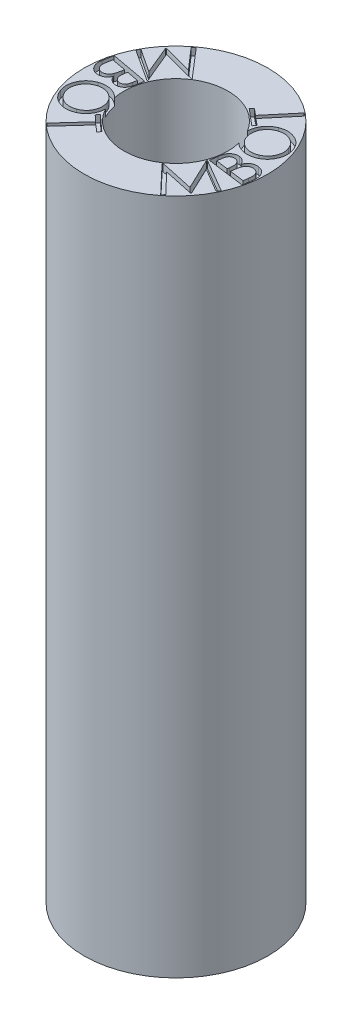
from build123d import *

# Parameters (mm, degrees)
SKETCH1_R           = 3.8
SKETCH1_R_2         = 2.15
BOSS_EXTRUDE1_DEPTH = 28
CUT_EXTRUDE1_DEPTH  = 0.3


with BuildPart() as part:
    # Sketch1 → Boss-Extrude1 (new body)
    with BuildSketch(Plane(origin=(0, 0, 0), x_dir=(1, 0, 0), z_dir=(0, 1, 0))):
        with Locations(Location((0, 0, 0), (0, 0, 270))):
            Circle(SKETCH1_R)
        with Locations(Location((0, 0, 0), (0, 0, 270))):
            Circle(SKETCH1_R_2, mode=Mode.SUBTRACT)
    extrude(amount=BOSS_EXTRUDE1_DEPTH)

    # Sketch5 → Cut-Extrude1 (cut)
    # profile 1 of 8: a face of its own
    with BuildSketch(Plane(origin=(0, 28, 0), x_dir=(1, 0, 0), z_dir=(0, 1, 0))):
        Polygon((2.329630541, -2.964133003), (1.227093983, -1.803082823), (1.242994424, -1.783048267), (2.662903779, -2.08547465), (2.039606503, -0.777822406), (2.055824952, -0.757469842), (3.439481303, -1.563622186), (3.342170606, -1.686373588), (2.357615317, -1.10378144), (2.897912292, -2.247023127), (2.873107605, -2.278506), (1.624923009, -2.013604658), (2.424715177, -2.84424368), align=None)
    # profile 2 of 8: a face of its own
    with BuildSketch(Plane(origin=(0, 28, 0), x_dir=(1, 0, 0), z_dir=(0, 1, 0))):
        with BuildLine():
            Line((2.093235979, -0.715965441), (2.134259116, -0.407496891))
            add(Edge.make_bspline(
                [(2.134259116, -0.407496891), (2.136386266, -0.392429351), (2.140501561, -0.363278903), (2.148119693, -0.321032291), (2.157029972, -0.281695393), (2.166773772, -0.24516186), (2.177573031, -0.211604428), (2.189423383, -0.180956688), (2.201837571, -0.152895384), (2.220633469, -0.120023992), (2.24666193, -0.082957763), (2.283862184, -0.044715463), (2.325806995, -0.01201122), (2.373036733, 0.01322043), (2.423060482, 0.03308958), (2.475692439, 0.044186614), (2.529781919, 0.048973149), (2.565915283, 0.045301708), (2.584241588, 0.043439607)],
                knots=[0, 0, 0, 0, 1.010492077, 1.954950526, 2.849835635, 3.6882845, 4.465225562, 5.18948145, 5.869957772, 6.500383296, 7.701699132, 8.866658841, 10.031107976, 11.218795508, 12.4110639, 13.593042317, 14.779226817, 16, 16, 16, 16], degree=3))
            add(Edge.make_bspline(
                [(2.584241588, 0.043439607), (2.601193217, 0.040473985), (2.634571517, 0.034634581), (2.682445123, 0.018601863), (2.726796866, -0.004091918), (2.767940708, -0.032322519), (2.804931653, -0.066542604), (2.837419246, -0.106168686), (2.865124596, -0.151274755), (2.878747978, -0.184459178), (2.885713944, -0.20142718)],
                knots=[0, 0, 0, 0, 1.009141512, 1.98703192, 2.949821253, 3.924956337, 4.906876531, 5.897139441, 6.924756299, 8, 8, 8, 8], degree=3))
            add(Edge.make_bspline(
                [(2.885713944, -0.20142718), (2.89530569, -0.183045396), (2.913565789, -0.148051431), (2.943796678, -0.100370392), (2.974856322, -0.059972172), (3.007275793, -0.026458196), (3.041267223, 0.001425224), (3.077519354, 0.024722129), (3.116006399, 0.044265986), (3.156912499, 0.059210154), (3.199585367, 0.069628841), (3.243471151, 0.075790248), (3.288525047, 0.07681903), (3.3185435, 0.073663126), (3.333788363, 0.0720604)],
                knots=[0, 0, 0, 0, 1.318659286, 2.510372038, 3.586869774, 4.555018033, 5.470331833, 6.377585435, 7.291432246, 8.211009337, 9.141696873, 10.081139435, 11.025507152, 12, 12, 12, 12], degree=3))
            add(Edge.make_bspline(
                [(3.333788363, 0.0720604), (3.349116564, 0.069615985), (3.37936596, 0.064792061), (3.423080884, 0.05224959), (3.464321257, 0.035528557), (3.503480767, 0.0152818), (3.539756938, -0.009780892), (3.573649179, -0.038633678), (3.605419448, -0.07131323), (3.634393713, -0.107958846), (3.660119019, -0.147817752), (3.681523856, -0.190357979), (3.698517441, -0.23521639), (3.71086791, -0.282550348), (3.718921913, -0.332384858), (3.721726551, -0.384663586), (3.721039716, -0.439231466), (3.716885993, -0.476103241), (3.714762922, -0.494949315)],
                knots=[0, 0, 0, 0, 0.972846954, 1.91986211, 2.844560866, 3.760494506, 4.678837868, 5.603321497, 6.548350927, 7.532670636, 8.528530662, 9.518626182, 10.513864628, 11.531414505, 12.581795599, 13.674155164, 14.811203275, 16, 16, 16, 16], degree=3))
            Line((3.714762922, -0.494949315), (3.657521336, -0.924579223))
            Line((3.657521336, -0.924579223), (2.093235979, -0.715965441))
        make_face()
        with BuildLine():
            Line((2.266868792, -0.583355766), (2.767732674, -0.650137616))
            Line((2.767732674, -0.650137616), (2.779499, -0.56077714))
            add(Edge.make_bspline(
                [(2.779499, -0.56077714), (2.78115923, -0.547640968), (2.784368254, -0.522250327), (2.787876549, -0.485344488), (2.79009341, -0.451092713), (2.791279363, -0.419371959), (2.790443894, -0.390307046), (2.789126709, -0.363634235), (2.785973029, -0.339613466), (2.78007089, -0.311349699), (2.769756007, -0.278958001), (2.752122322, -0.24340643), (2.729668375, -0.211071597), (2.702164937, -0.18306515), (2.67152079, -0.158644049), (2.637489112, -0.139920522), (2.601004277, -0.125983293), (2.575339747, -0.121605413), (2.56229898, -0.119380906)],
                knots=[0, 0, 0, 0, 1.138442701, 2.200472903, 3.186909168, 4.089663252, 4.928399444, 5.686278047, 6.38495409, 7.008817847, 8.167548536, 9.296648921, 10.409220836, 11.537253861, 12.660415745, 13.766134315, 14.864918994, 16, 16, 16, 16], degree=3))
            add(Edge.make_bspline(
                [(2.56229898, -0.119380906), (2.553511374, -0.118497579), (2.536389248, -0.116776468), (2.511120296, -0.116612732), (2.487005545, -0.119536438), (2.464041868, -0.12507009), (2.441869548, -0.132487832), (2.421226169, -0.143235763), (2.401470606, -0.156049104), (2.383091011, -0.171641272), (2.365995637, -0.19008602), (2.350412765, -0.211367428), (2.336781392, -0.235957638), (2.324338982, -0.263356807), (2.313636805, -0.293934026), (2.30459409, -0.327460952), (2.296374973, -0.363791497), (2.292858924, -0.389230347), (2.291037462, -0.40240875)],
                knots=[0, 0, 0, 0, 0.950473913, 1.85194156, 2.713905182, 3.558086579, 4.391713354, 5.223541917, 6.055918173, 6.922326683, 7.810479481, 8.757659798, 9.75408104, 10.831618649, 11.993747566, 13.236759292, 14.568524148, 16, 16, 16, 16], degree=3))
            Line((2.291037462, -0.40240875), (2.266868792, -0.583355766))
        make_face(mode=Mode.SUBTRACT)
        with BuildLine():
            Line((2.925147037, -0.671126198), (3.524593652, -0.751264419))
            Line((3.524593652, -0.751264419), (3.550352366, -0.557597052))
            add(Edge.make_bspline(
                [(3.550352366, -0.557597052), (3.552153449, -0.543828126), (3.555638926, -0.51718234), (3.558974021, -0.47844883), (3.561431739, -0.442404461), (3.561953166, -0.409088741), (3.561551703, -0.378512614), (3.559224862, -0.350710568), (3.55594797, -0.325477107), (3.549192061, -0.295781234), (3.537368704, -0.261755065), (3.518175463, -0.224062191), (3.493458991, -0.189690474), (3.463536834, -0.159425306), (3.430256543, -0.133462816), (3.394050712, -0.11308558), (3.355559136, -0.098375275), (3.328595408, -0.093521032), (3.315025843, -0.091078121)],
                knots=[0, 0, 0, 0, 1.126627012, 2.180261895, 3.154089933, 4.057406986, 4.88332626, 5.634071565, 6.320142425, 6.946160866, 8.10224948, 9.233235086, 10.367127989, 11.522800553, 12.675524478, 13.780837104, 14.883200617, 16, 16, 16, 16], degree=3))
            add(Edge.make_bspline(
                [(3.315025843, -0.091078121), (3.297961476, -0.089581196), (3.264562852, -0.086651393), (3.214725076, -0.093402357), (3.167335455, -0.109278542), (3.122766119, -0.134009711), (3.081930605, -0.16650165), (3.046280306, -0.206734905), (3.015567894, -0.253934574), (3.000610023, -0.289347901), (2.992882914, -0.307642124)],
                knots=[0, 0, 0, 0, 0.975195556, 1.908666771, 2.846069973, 3.812671006, 4.80281988, 5.80962802, 6.868472574, 8, 8, 8, 8], degree=3))
            add(Edge.make_bspline(
                [(2.992882914, -0.307642124), (2.990386491, -0.314724774), (2.985024226, -0.329938156), (2.977667325, -0.354949229), (2.970925287, -0.383783656), (2.963869569, -0.416320722), (2.956949315, -0.452596285), (2.949917491, -0.492542068), (2.943295959, -0.536354032), (2.939102875, -0.566814261), (2.936913363, -0.582719748)],
                knots=[0, 0, 0, 0, 0.640922909, 1.37668893, 2.223753324, 3.16784577, 4.218320023, 5.375583151, 6.629602244, 8, 8, 8, 8], degree=3))
            Line((2.936913363, -0.582719748), (2.925147037, -0.671126198))
        make_face(mode=Mode.SUBTRACT)
    # profile 3 of 8: a face of its own
    with BuildSketch(Plane(origin=(0, 28, 0), x_dir=(1, 0, 0), z_dir=(0, 1, 0))):
        with BuildLine():
            add(Edge.make_bspline(
                [(1.903773327, 0.784406789), (1.893312162, 0.811799631), (1.872709074, 0.865749369), (1.850826798, 0.948287825), (1.837232328, 1.030395749), (1.832148913, 1.111903426), (1.835187697, 1.193032367), (1.84727733, 1.273410426), (1.86692837, 1.353395094), (1.895307748, 1.431774342), (1.930598895, 1.507105543), (1.971957653, 1.577969527), (2.019923047, 1.642817534), (2.074054695, 1.701949106), (2.133950636, 1.75571152), (2.200421574, 1.803084506), (2.27240279, 1.845594185), (2.32403111, 1.868374842), (2.350257702, 1.879947153)],
                knots=[0, 0, 0, 0, 1.0654412, 2.09836841, 3.098110652, 4.08658876, 5.062342022, 6.04389219, 7.036508341, 8.051911371, 9.069067994, 10.057162908, 11.029867363, 11.995499962, 12.967127432, 13.950015722, 14.958631591, 16, 16, 16, 16], degree=3))
            add(Edge.make_bspline(
                [(2.350257702, 1.879947153), (2.376792525, 1.890133892), (2.429005749, 1.910178588), (2.509454042, 1.930582205), (2.589571079, 1.943781692), (2.669743943, 1.947637467), (2.749698984, 1.944110277), (2.829322178, 1.931278323), (2.908822575, 1.91096153), (2.9870548, 1.882299791), (3.062591577, 1.847190383), (3.133168581, 1.805217842), (3.198462997, 1.7578979), (3.257614764, 1.704032994), (3.311037385, 1.64426044), (3.358397845, 1.578368135), (3.400623928, 1.506859151), (3.423198627, 1.455659023), (3.434667758, 1.429646673)],
                knots=[0, 0, 0, 0, 1.042580017, 2.051510351, 3.040546498, 4.018567053, 4.992507237, 5.973248902, 6.973671327, 8.000291144, 9.02736072, 10.027063942, 11.010080281, 11.982503429, 12.958105746, 13.947417434, 14.957180371, 16, 16, 16, 16], degree=3))
            add(Edge.make_bspline(
                [(3.434667758, 1.429646673), (3.444915579, 1.402783004), (3.465093661, 1.349888121), (3.486424958, 1.268734794), (3.499303979, 1.187866563), (3.503663791, 1.107215423), (3.500437705, 1.026827449), (3.487892205, 0.946790475), (3.468028459, 0.866998731), (3.439274577, 0.788688158), (3.403977798, 0.713404904), (3.363123869, 0.642464431), (3.315300846, 0.578138507), (3.262238059, 0.519052324), (3.203256697, 0.465926891), (3.138524415, 0.418387742), (3.067645191, 0.377297398), (3.017234509, 0.354755159), (2.99168148, 0.343328564)],
                knots=[0, 0, 0, 0, 1.055830582, 2.078942983, 3.076562134, 4.059560474, 5.041979955, 6.026859162, 7.0309954, 8.058538785, 9.086532333, 10.083185466, 11.060806588, 12.025989644, 12.996673523, 13.971987714, 14.972006452, 16, 16, 16, 16], degree=3))
            add(Edge.make_bspline(
                [(2.99168148, 0.343328564), (2.974178528, 0.336386036), (2.939368036, 0.322578493), (2.885880608, 0.306689164), (2.832195677, 0.293738086), (2.778211629, 0.284623597), (2.723845442, 0.278709677), (2.669116641, 0.276944194), (2.613994482, 0.278517703), (2.558868227, 0.283600677), (2.504345858, 0.292065962), (2.451065265, 0.304286822), (2.399217518, 0.319515275), (2.348771129, 0.33790465), (2.300017389, 0.360061645), (2.252588386, 0.385130311), (2.206576299, 0.413588381), (2.162271785, 0.445241084), (2.120237593, 0.479702415), (2.080803869, 0.516538788), (2.044204397, 0.55560177), (2.010609142, 0.597141092), (1.979033907, 0.640319612), (1.951395413, 0.686383129), (1.925458943, 0.734110429), (1.911046929, 0.767536819), (1.903773327, 0.784406789)],
                knots=[0, 0, 0, 0, 1.037653303, 2.063721596, 3.072992308, 4.080857644, 5.079924507, 6.085737525, 7.097205503, 8.118385624, 9.135896792, 10.136825087, 11.129874092, 12.113506166, 13.094391291, 14.080000588, 15.069328101, 16.074801489, 17.079765218, 18.063848587, 19.047931957, 20.02822496, 21.00789062, 21.994158109, 22.987671321, 24, 24, 24, 24], degree=3))
        make_face()
        with BuildLine():
            add(Edge.make_bspline(
                [(2.044015214, 0.850552622), (2.049744542, 0.837203671), (2.061125717, 0.810686293), (2.081851815, 0.77269482), (2.104580963, 0.736193513), (2.129961624, 0.701309274), (2.157482676, 0.66797279), (2.187687496, 0.636350895), (2.219986519, 0.606062952), (2.254900909, 0.578019602), (2.291376325, 0.551923728), (2.329101535, 0.528475711), (2.367858343, 0.50763317), (2.407556577, 0.489494278), (2.448354683, 0.474166341), (2.490163593, 0.461842375), (2.532818768, 0.451856066), (2.576393178, 0.444958466), (2.620474022, 0.440672108), (2.664772538, 0.440019701), (2.709010609, 0.441177281), (2.753123058, 0.446758185), (2.79729953, 0.454030705), (2.841386406, 0.46519546), (2.885548996, 0.478610915), (2.914473901, 0.489948047), (2.929033744, 0.495654785)],
                knots=[0, 0, 0, 0, 0.985772182, 1.958213211, 2.934693914, 3.903532952, 4.884907928, 5.867417, 6.870585278, 7.888922104, 8.905426197, 9.913949962, 10.902476839, 11.891213282, 12.87506575, 13.858760266, 14.848622371, 15.847236651, 16.851978487, 17.852587691, 18.853610927, 19.853443361, 20.868621756, 21.891500729, 22.938650967, 24, 24, 24, 24], degree=3))
            add(Edge.make_bspline(
                [(2.929033744, 0.495654785), (2.9501094, 0.505016839), (2.99160104, 0.523447911), (3.049628485, 0.55740721), (3.102883893, 0.59584009), (3.151473258, 0.638792505), (3.194778331, 0.686724788), (3.233233502, 0.739097502), (3.267131152, 0.795849809), (3.295319043, 0.856825122), (3.318083131, 0.919934881), (3.334851545, 0.983761102), (3.344824155, 1.047698256), (3.347924712, 1.111636132), (3.344839007, 1.175584404), (3.334790867, 1.239489812), (3.318318768, 1.303436228), (3.302464746, 1.344979932), (3.294425871, 1.36604491)],
                knots=[0, 0, 0, 0, 1.052617708, 2.072288217, 3.06394441, 4.048162943, 5.028408386, 6.008330982, 7.011314847, 8.042289403, 9.071386676, 10.07184354, 11.051670456, 12.021144701, 12.990618947, 13.970445863, 14.970902727, 16, 16, 16, 16], degree=3))
            add(Edge.make_bspline(
                [(3.294425871, 1.36604491), (3.288339879, 1.380009591), (3.276323342, 1.407582272), (3.255458116, 1.447357995), (3.232146335, 1.485177414), (3.206867375, 1.521449872), (3.179034152, 1.555590803), (3.148978635, 1.587780427), (3.116902984, 1.618380873), (3.082601565, 1.646829711), (3.046844978, 1.673271929), (3.009585065, 1.696747506), (2.971301562, 1.717615581), (2.931760985, 1.735301141), (2.891365252, 1.750688567), (2.849820134, 1.763169033), (2.807162776, 1.772575923), (2.763644515, 1.779631585), (2.719663101, 1.783817043), (2.675458618, 1.78467925), (2.631373214, 1.782813892), (2.587298825, 1.777974179), (2.543278585, 1.770416023), (2.499454457, 1.759484545), (2.455584337, 1.745800059), (2.426835549, 1.734578557), (2.412269421, 1.728892967)],
                knots=[0, 0, 0, 0, 1.030548109, 2.034774194, 3.036152788, 4.035113646, 5.024292458, 6.013965269, 7.013466766, 8.02185973, 9.027544907, 10.020539299, 10.999444249, 11.975375117, 12.949221365, 13.922750572, 14.90770734, 15.902978888, 16.904357482, 17.8944461, 18.892402135, 19.888087153, 20.892799837, 21.912254857, 22.942203694, 24, 24, 24, 24], degree=3))
            add(Edge.make_bspline(
                [(2.412269421, 1.728892967), (2.398094491, 1.722695106), (2.370014872, 1.710417547), (2.329548048, 1.689292106), (2.291011483, 1.666304971), (2.255029244, 1.640431673), (2.220515645, 1.613430132), (2.188755434, 1.583518847), (2.158673214, 1.551999992), (2.130808108, 1.518440876), (2.105406385, 1.4831056), (2.082334604, 1.446419108), (2.062071673, 1.408208376), (2.044088757, 1.368781951), (2.029338379, 1.327830886), (2.016326069, 1.28580484), (2.006677805, 1.242163149), (1.999327297, 1.197585848), (1.994877185, 1.152541494), (1.993409865, 1.107727217), (1.994118092, 1.063418149), (1.998389014, 1.019759287), (2.005392022, 0.9766291), (2.015271652, 0.934032204), (2.027947294, 0.891821903), (2.038634405, 0.864372839), (2.044015214, 0.850552622)],
                knots=[0, 0, 0, 0, 1.050823242, 2.08161283, 3.099362736, 4.096492701, 5.090783653, 6.074295993, 7.057491853, 8.049693955, 9.035103037, 10.012266315, 10.991735883, 11.971629006, 12.95366357, 13.947015083, 14.958630831, 15.987531717, 17.01517154, 18.031289292, 19.032597937, 20.023701631, 21.008794843, 21.999348877, 22.992700389, 24, 24, 24, 24], degree=3))
        make_face(mode=Mode.SUBTRACT)
    # profile 4 of 8: a face of its own
    with BuildSketch(Plane(origin=(0, 28, 0), x_dir=(1, 0, 0), z_dir=(0, 1, 0))):
        Polygon((1.836431063, 1.514654737), (1.737848331, 1.396991476), (1.072255883, 1.955414953), (1.170838615, 2.073078214), (1.441464116, 1.846019921), (2.360827598, 2.941560286), (2.484533026, 2.837889412), (1.565169545, 1.742349048), align=None)
    # profile 5 of 8: a face of its own
    with BuildSketch(Plane(origin=(0, 28, 0), x_dir=(1, 0, 0), z_dir=(0, 1, 0))):
        Polygon((-2.215025584, 3.052642951), (-1.17831685, 1.848025564), (-1.194853308, 1.828945035), (-2.588049923, 2.197835259), (-2.033442551, 0.871102487), (-2.050297018, 0.851703949), (-3.383071958, 1.718277967), (-3.28067312, 1.834987202), (-2.332688845, 1.209463865), (-2.813200163, 2.36924201), (-2.78712344, 2.399134838), (-1.562471497, 2.076355892), (-2.314880351, 2.938477787), align=None)
    # profile 6 of 8: a face of its own
    with BuildSketch(Plane(origin=(0, 28, 0), x_dir=(1, 0, 0), z_dir=(0, 1, 0))):
        with BuildLine():
            Line((-2.071357534, 0.780700688), (-2.127645094, 0.475094217))
            add(Edge.make_bspline(
                [(-2.127645094, 0.475094217), (-2.130503997, 0.460230628), (-2.136078004, 0.431251066), (-2.145993134, 0.389498369), (-2.156314704, 0.350593317), (-2.16786591, 0.314750253), (-2.180171715, 0.281700861), (-2.19338732, 0.25145484), (-2.20779928, 0.224345018), (-2.227474528, 0.192237631), (-2.255491615, 0.156897769), (-2.294112725, 0.12040441), (-2.337818192, 0.090175819), (-2.386066793, 0.066914484), (-2.437104724, 0.050307298), (-2.489999967, 0.04134226), (-2.544158672, 0.039778907), (-2.580107676, 0.045032177), (-2.598298139, 0.047690371)],
                knots=[0, 0, 0, 0, 1.00663649, 1.962640647, 2.853729908, 3.68319098, 4.46631897, 5.198668758, 5.876776699, 6.506812784, 7.701556656, 8.863713625, 10.029351552, 11.221304401, 12.414195262, 13.58723036, 14.779120649, 16, 16, 16, 16], degree=3))
            add(Edge.make_bspline(
                [(-2.598298139, 0.047690371), (-2.615087502, 0.051329054), (-2.648084862, 0.058480422), (-2.694714839, 0.077690346), (-2.738312276, 0.10165514), (-2.777839249, 0.132123755), (-2.813151943, 0.168003517), (-2.843385827, 0.209250127), (-2.868654908, 0.255700172), (-2.880808659, 0.28929641), (-2.887050142, 0.306549546)],
                knots=[0, 0, 0, 0, 1.00808686, 1.981266667, 2.952109378, 3.925528571, 4.903782706, 5.902115156, 6.922644458, 8, 8, 8, 8], degree=3))
            add(Edge.make_bspline(
                [(-2.887050142, 0.306549546), (-2.897482271, 0.288672586), (-2.917346898, 0.254631677), (-2.950009634, 0.208678858), (-2.982421933, 0.169374299), (-3.016509561, 0.137577942), (-3.051877446, 0.111660253), (-3.089126743, 0.090202878), (-3.128506322, 0.072633019), (-3.170030638, 0.059669665), (-3.212964698, 0.050862757), (-3.257037912, 0.047707624), (-3.301964016, 0.048228949), (-3.331767635, 0.052934729), (-3.346890887, 0.055322583)],
                knots=[0, 0, 0, 0, 1.318356294, 2.510384727, 3.58892852, 4.559139976, 5.472469055, 6.377365833, 7.293687642, 8.21448031, 9.144469175, 10.079620131, 11.025541494, 12, 12, 12, 12], degree=3))
            add(Edge.make_bspline(
                [(-3.346890887, 0.055322583), (-3.362026474, 0.058503835), (-3.391969342, 0.064797335), (-3.43486702, 0.079626973), (-3.475277444, 0.098108857), (-3.513018566, 0.120626962), (-3.548567681, 0.146619591), (-3.581039547, 0.177185371), (-3.611171424, 0.211403355), (-3.63820075, 0.249398427), (-3.66231074, 0.290226905), (-3.681194841, 0.33402521), (-3.696085782, 0.379756188), (-3.705804901, 0.427779313), (-3.711166591, 0.477814121), (-3.7120846, 0.530062804), (-3.708261726, 0.584431752), (-3.70229282, 0.621098179), (-3.699244653, 0.639822783)],
                knots=[0, 0, 0, 0, 0.969793175, 1.918550522, 2.841273926, 3.753967429, 4.672002961, 5.599247377, 6.546697831, 7.528801654, 8.521437843, 9.516367295, 10.515646089, 11.534571192, 12.585080277, 13.669581761, 14.809915174, 16, 16, 16, 16], degree=3))
            Line((-3.699244653, 0.639822783), (-3.621014485, 1.065318576))
            Line((-3.621014485, 1.065318576), (-2.071357534, 0.780700688))
        make_face()
        with BuildLine():
            Line((-2.251032514, 0.656995259), (-2.747126264, 0.74794578))
            Line((-2.747126264, 0.74794578), (-2.763344713, 0.65953933))
            add(Edge.make_bspline(
                [(-2.763344713, 0.65953933), (-2.765625525, 0.646510176), (-2.770031231, 0.621342555), (-2.775518388, 0.584783145), (-2.779402493, 0.550737614), (-2.781615911, 0.51911409), (-2.782591998, 0.490050125), (-2.782453381, 0.46339639), (-2.780523462, 0.439287061), (-2.776447055, 0.410690871), (-2.767646025, 0.377952238), (-2.751738945, 0.341707596), (-2.731096306, 0.308393276), (-2.705173716, 0.278827029), (-2.67542787, 0.253509567), (-2.642588474, 0.232891496), (-2.606956903, 0.217137933), (-2.581571708, 0.211471051), (-2.568723319, 0.208602831)],
                knots=[0, 0, 0, 0, 1.13936992, 2.200851349, 3.18399813, 4.090228388, 4.930730959, 5.688662629, 6.384781242, 7.012370336, 8.175208003, 9.291475818, 10.411323097, 11.537444079, 12.664527147, 13.764050466, 14.868302939, 16, 16, 16, 16], degree=3))
            add(Edge.make_bspline(
                [(-2.568723319, 0.208602831), (-2.560050111, 0.207261182), (-2.543089222, 0.20463752), (-2.517822744, 0.20374199), (-2.493515229, 0.205269044), (-2.470251422, 0.209391381), (-2.447957755, 0.21604157), (-2.426998396, 0.225822875), (-2.406664183, 0.237571989), (-2.387530601, 0.252313878), (-2.369648959, 0.269971744), (-2.353006892, 0.290543297), (-2.337692057, 0.314167594), (-2.324220056, 0.341062859), (-2.311665391, 0.370736849), (-2.301050832, 0.40368212), (-2.291444453, 0.439658648), (-2.286400766, 0.464885314), (-2.283787422, 0.477956297)],
                knots=[0, 0, 0, 0, 0.944954498, 1.847905489, 2.717818052, 3.564707142, 4.388483539, 5.216524553, 6.050999793, 6.914515577, 7.811014505, 8.752857749, 9.760285637, 10.838092965, 11.989913049, 13.228767073, 14.564109175, 16, 16, 16, 16], degree=3))
            Line((-2.283787422, 0.477956297), (-2.251032514, 0.656995259))
        make_face(mode=Mode.SUBTRACT)
        with BuildLine():
            Line((-2.903268591, 0.776566573), (-3.497309056, 0.885643596))
            Line((-3.497309056, 0.885643596), (-3.532608035, 0.693884282))
            add(Edge.make_bspline(
                [(-3.532608035, 0.693884282), (-3.535026891, 0.680223805), (-3.539704271, 0.653808327), (-3.545056708, 0.615409111), (-3.549038785, 0.579569946), (-3.551102724, 0.546355748), (-3.552418933, 0.515798481), (-3.551250826, 0.487883748), (-3.549299312, 0.462568115), (-3.544216708, 0.432557532), (-3.534019362, 0.398097168), (-3.516271801, 0.359861176), (-3.493507681, 0.324323601), (-3.465285901, 0.292650433), (-3.433383504, 0.264867858), (-3.398192757, 0.242802932), (-3.360402216, 0.226435827), (-3.333868741, 0.220287673), (-3.320496156, 0.217189069)],
                knots=[0, 0, 0, 0, 1.127440971, 2.180150191, 3.150604534, 4.057235988, 4.884723999, 5.634714604, 6.326584942, 6.946957963, 8.105569315, 9.235016498, 10.362984034, 11.522779978, 12.671256805, 13.789973674, 14.886170486, 16, 16, 16, 16], degree=3))
            add(Edge.make_bspline(
                [(-3.320496156, 0.217189069), (-3.303567226, 0.214820614), (-3.2703674, 0.210175768), (-3.220458043, 0.21480548), (-3.1724474, 0.227980047), (-3.126936501, 0.250605878), (-3.08456058, 0.281091649), (-3.047042748, 0.31969537), (-3.014115683, 0.36531666), (-2.997217481, 0.39975712), (-2.988494954, 0.417534622)],
                knots=[0, 0, 0, 0, 0.974228791, 1.910588921, 2.841050041, 3.805679912, 4.799474869, 5.810572028, 6.869859419, 8, 8, 8, 8], degree=3))
            add(Edge.make_bspline(
                [(-2.988494954, 0.417534622), (-2.985678821, 0.424401299), (-2.97954237, 0.439364032), (-2.971051562, 0.463959767), (-2.963060141, 0.492556221), (-2.953900645, 0.524422246), (-2.945537309, 0.560373566), (-2.936599941, 0.599883321), (-2.927690708, 0.643246386), (-2.922085577, 0.673415902), (-2.919169032, 0.689114149)],
                knots=[0, 0, 0, 0, 0.634365921, 1.382305795, 2.222483119, 3.17220736, 4.216162988, 5.376912608, 6.635116451, 8, 8, 8, 8], degree=3))
            Line((-2.919169032, 0.689114149), (-2.903268591, 0.776566573))
        make_face(mode=Mode.SUBTRACT)
    # profile 7 of 8: a face of its own
    with BuildSketch(Plane(origin=(0, 28, 0), x_dir=(1, 0, 0), z_dir=(0, 1, 0))):
        with BuildLine():
            add(Edge.make_bspline(
                [(-1.942002264, -0.708807704), (-1.932560459, -0.736422659), (-1.91397697, -0.790774786), (-1.895740998, -0.873831928), (-1.88532926, -0.955903421), (-1.883333067, -1.037115395), (-1.889877971, -1.117420866), (-1.904039643, -1.197001695), (-1.927334425, -1.27564169), (-1.958271323, -1.352599028), (-1.996212655, -1.426248564), (-2.040066201, -1.495096381), (-2.090302461, -1.557553669), (-2.145987055, -1.614528036), (-2.208015457, -1.6649736), (-2.275466418, -1.710170404), (-2.348932941, -1.749220151), (-2.401097244, -1.769959715), (-2.427601723, -1.780497407)],
                knots=[0, 0, 0, 0, 1.066043645, 2.098201422, 3.101663377, 4.086086705, 5.061694136, 6.042098489, 7.035236788, 8.05404335, 9.069521638, 10.059397024, 11.032415855, 11.994105693, 12.965982121, 13.949261028, 14.958027507, 16, 16, 16, 16], degree=3))
            add(Edge.make_bspline(
                [(-2.427601723, -1.780497407), (-2.454368858, -1.789632594), (-2.507032599, -1.80760587), (-2.587788715, -1.824793808), (-2.667936565, -1.834835014), (-2.747759392, -1.835383927), (-2.827097917, -1.829088305), (-2.905754835, -1.813365387), (-2.984050709, -1.790077042), (-3.060921711, -1.75882232), (-3.134466318, -1.720518974), (-3.203417059, -1.67673925), (-3.265869219, -1.626374835), (-3.323026551, -1.570909182), (-3.373642136, -1.509189964), (-3.418308712, -1.441898142), (-3.457602993, -1.369216047), (-3.478081764, -1.317393092), (-3.488479127, -1.291081842)],
                knots=[0, 0, 0, 0, 1.042529674, 2.051153862, 3.039656217, 4.017332673, 4.990588494, 5.970694041, 6.970371657, 8.000061442, 9.026724701, 10.025752011, 11.00776692, 11.98114057, 12.958981238, 13.945927706, 14.957118362, 16, 16, 16, 16], degree=3))
            add(Edge.make_bspline(
                [(-3.488479127, -1.291081842), (-3.49772018, -1.263997073), (-3.515904666, -1.210699831), (-3.533384155, -1.129094557), (-3.543740481, -1.048221095), (-3.544755212, -0.967848465), (-3.538244394, -0.888120148), (-3.522929508, -0.809146709), (-3.500197171, -0.730590639), (-3.4685015, -0.653994804), (-3.430948023, -0.580315024), (-3.386734172, -0.511979462), (-3.337418273, -0.449172403), (-3.282073853, -0.392832841), (-3.221608852, -0.341965839), (-3.155086069, -0.297891723), (-3.083244775, -0.259292076), (-3.032250257, -0.238940126), (-3.006377765, -0.228614394)],
                knots=[0, 0, 0, 0, 1.056338801, 2.078656947, 3.076758029, 4.063658458, 5.042148692, 6.026700262, 7.030392991, 8.057865156, 9.084135288, 10.081237308, 11.059719707, 12.028888675, 12.993514248, 13.973124274, 14.971647735, 16, 16, 16, 16], degree=3))
            add(Edge.make_bspline(
                [(-3.006377765, -0.228614394), (-2.988638491, -0.22246268), (-2.953477005, -0.210269202), (-2.899850576, -0.195880967), (-2.846027991, -0.185586716), (-2.79213522, -0.178015175), (-2.737922542, -0.174509626), (-2.683442719, -0.175069597), (-2.628705595, -0.178296155), (-2.574166481, -0.185865026), (-2.520240116, -0.196085746), (-2.467699949, -0.210214904), (-2.416698917, -0.227375934), (-2.367290063, -0.247764638), (-2.319507105, -0.271385866), (-2.273225225, -0.298004486), (-2.228948174, -0.328543583), (-2.186235433, -0.361741385), (-2.145550765, -0.397427579), (-2.108052731, -0.435879375), (-2.072885462, -0.47592867), (-2.040640091, -0.518232825), (-2.011852802, -0.563018858), (-1.985186826, -0.609406046), (-1.962027595, -0.658233736), (-1.94870665, -0.691875778), (-1.942002264, -0.708807704)],
                knots=[0, 0, 0, 0, 1.040354973, 2.062115291, 3.073708417, 4.075703017, 5.076508572, 6.081117555, 7.093648486, 8.11310929, 9.130468949, 10.133685589, 11.125745326, 12.110910159, 13.093531813, 14.077995736, 15.067093937, 16.07184033, 17.074919351, 18.063633646, 19.0462553, 20.02736547, 21.008317328, 21.994952453, 22.990866346, 24, 24, 24, 24], degree=3))
        make_face()
        with BuildLine():
            add(Edge.make_bspline(
                [(-2.084152204, -0.76891137), (-2.089378274, -0.755478829), (-2.099814551, -0.728654522), (-2.118658917, -0.689870692), (-2.140058259, -0.652680826), (-2.163550447, -0.616765204), (-2.190090032, -0.582875069), (-2.21874012, -0.550360768), (-2.249791067, -0.519267166), (-2.283220822, -0.490043524), (-2.318430159, -0.462681759), (-2.355033206, -0.437930312), (-2.392536543, -0.41556806), (-2.431179948, -0.396034017), (-2.47109753, -0.379515927), (-2.512118165, -0.365570175), (-2.554232813, -0.353971599), (-2.597397216, -0.345481203), (-2.641164638, -0.33977434), (-2.685142335, -0.336892611), (-2.729120133, -0.336908828), (-2.773219624, -0.339733068), (-2.817443602, -0.345745442), (-2.861625733, -0.355238368), (-2.906152942, -0.366756145), (-2.935316449, -0.377015453), (-2.950090205, -0.382212652)],
                knots=[0, 0, 0, 0, 0.983530851, 1.964076291, 2.939616799, 3.910908441, 4.890732822, 5.874982017, 6.867547092, 7.887863935, 8.903861521, 9.909292238, 10.902015538, 11.882480886, 12.862064798, 13.848253558, 14.83823073, 15.841472099, 16.848437726, 17.849066483, 18.847574013, 19.848202771, 20.863298199, 21.89069702, 22.931461599, 24, 24, 24, 24], degree=3))
            add(Edge.make_bspline(
                [(-2.950090205, -0.382212652), (-2.971380269, -0.390578669), (-3.013388523, -0.407085982), (-3.072174095, -0.438984247), (-3.126829553, -0.474952276), (-3.17645928, -0.516165077), (-3.221669363, -0.561852843), (-3.261981438, -0.612549386), (-3.297554181, -0.668003839), (-3.328192995, -0.727431677), (-3.353095449, -0.789322495), (-3.372092781, -0.852078548), (-3.384234712, -0.91517805), (-3.390000059, -0.978559078), (-3.389436887, -1.042293004), (-3.381986281, -1.1062158), (-3.367969831, -1.170353704), (-3.353835175, -1.21222778), (-3.346647196, -1.233522247)],
                knots=[0, 0, 0, 0, 1.04928377, 2.070382644, 3.063772501, 4.048879177, 5.026177815, 6.00963634, 7.016652671, 8.046147713, 9.074537972, 10.07530278, 11.051668019, 12.01920061, 12.992541328, 13.972248138, 14.968815556, 16, 16, 16, 16], degree=3))
            add(Edge.make_bspline(
                [(-3.346647196, -1.233522247), (-3.341246072, -1.247608293), (-3.33052939, -1.27555723), (-3.31074142, -1.315554622), (-3.289560262, -1.3542996), (-3.265714943, -1.39123362), (-3.239212795, -1.426089744), (-3.210817333, -1.459492881), (-3.179838623, -1.490866595), (-3.147050972, -1.520786364), (-3.112062516, -1.547881411), (-3.07605174, -1.572864194), (-3.038832316, -1.595205256), (-3.000328504, -1.614594791), (-2.96065559, -1.631161018), (-2.919920272, -1.645287537), (-2.87787702, -1.656256086), (-2.835004059, -1.664945147), (-2.79143616, -1.670594705), (-2.747566283, -1.673579357), (-2.703574769, -1.673144662), (-2.659600505, -1.669978795), (-2.615621756, -1.66391686), (-2.571672446, -1.654928518), (-2.527511728, -1.643279515), (-2.498558631, -1.633040743), (-2.483889283, -1.627853176)],
                knots=[0, 0, 0, 0, 1.02593331, 2.035613387, 3.033190496, 4.029489178, 5.023383106, 6.010660104, 7.010320927, 8.021416871, 9.028491716, 10.018820094, 11.002190204, 11.979537649, 12.949351099, 13.925580145, 14.910535996, 15.903513543, 16.900125461, 17.897572194, 18.892930577, 19.89087265, 20.895594423, 21.911207877, 22.941694617, 24, 24, 24, 24], degree=3))
            add(Edge.make_bspline(
                [(-2.483889283, -1.627853176), (-2.469503297, -1.62230972), (-2.440998857, -1.611325898), (-2.399997116, -1.591856917), (-2.36101975, -1.57016977), (-2.324144845, -1.546241791), (-2.288996112, -1.520461096), (-2.255862216, -1.492500488), (-2.224939306, -1.462105771), (-2.196023504, -1.429721324), (-2.169392397, -1.395480233), (-2.145240724, -1.359687891), (-2.12304657, -1.322850176), (-2.10401553, -1.284157475), (-2.087496327, -1.24408851), (-2.07343041, -1.202566449), (-2.062018419, -1.159634181), (-2.053232803, -1.115544526), (-2.046716202, -1.071085251), (-2.043714557, -1.026548357), (-2.042960035, -0.982485801), (-2.045100781, -0.938796734), (-2.05059941, -0.895667218), (-2.059029869, -0.85303478), (-2.069547934, -0.810495126), (-2.079262288, -0.782834768), (-2.084152204, -0.76891137)],
                knots=[0, 0, 0, 0, 1.052533593, 2.085493391, 3.096559554, 4.096499156, 5.085372474, 6.071566095, 7.054406482, 8.043915494, 9.034350827, 10.014147448, 10.991185846, 11.968867632, 12.955592463, 13.949091713, 14.960494704, 15.986915025, 17.017818219, 18.026627332, 19.032940033, 20.025964468, 21.010935215, 21.999039859, 22.992776432, 24, 24, 24, 24], degree=3))
        make_face(mode=Mode.SUBTRACT)
    # profile 8 of 8: a face of its own
    with BuildSketch(Plane(origin=(0, 28, 0), x_dir=(1, 0, 0), z_dir=(0, 1, 0))):
        Polygon((-1.896259016, -1.447255779), (-1.792906151, -1.333408624), (-1.151482373, -1.915046745), (-1.254835238, -2.0288939), (-1.515602465, -1.792613352), (-2.472808996, -2.848402614), (-2.592062301, -2.740279618), (-1.634855771, -1.684490355), align=None)
    extrude(amount=-CUT_EXTRUDE1_DEPTH, mode=Mode.SUBTRACT)


solid = part.part
